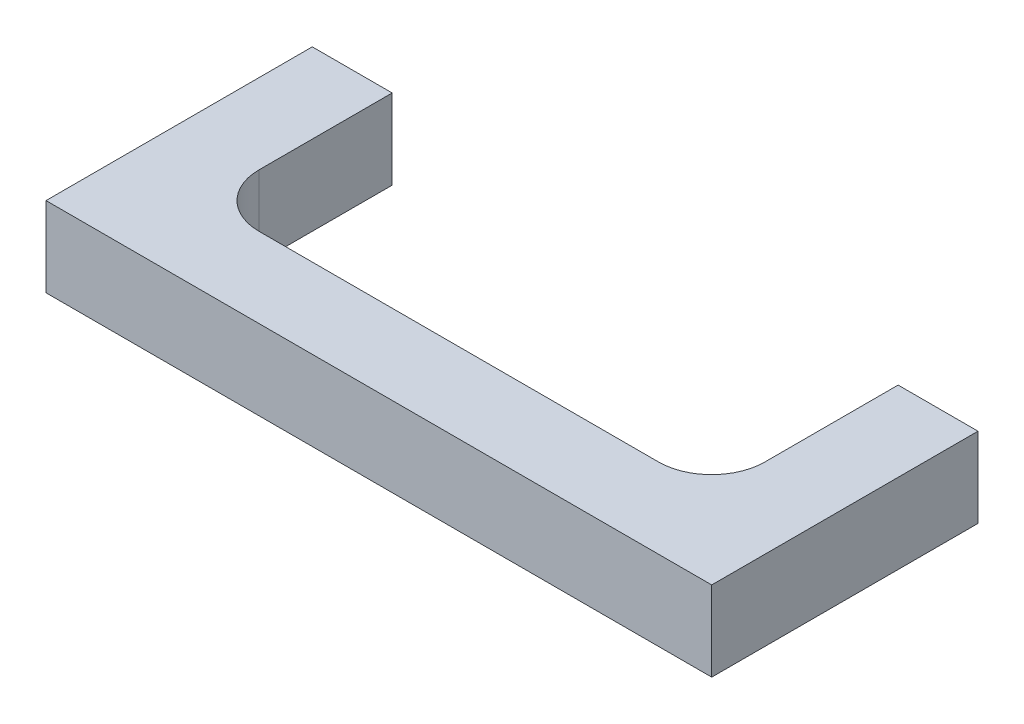
from build123d import *

# Parameters (mm, degrees)
SALIENTE_EXTRUIR1_DEPTH = 3
REDONDEO4_R             = 2
REDONDEO5_R             = 2


with BuildPart() as part:
    # Croquis1 → Saliente-Extruir1 (new body)
    with BuildSketch(Plane(origin=(0, 0, 0), x_dir=(1, 0, 0), z_dir=(0, 1, 0))):
        Polygon((12.5, 0), (-12.5, 0), (-12.5, 10), (-9.5, 10), (-9.5, 3), (9.5, 3), (9.5, 10), (12.5, 10), align=None)
    extrude(amount=-SALIENTE_EXTRUIR1_DEPTH)

    # Redondeo4
    redondeo4_edges = [part.edges().sort_by_distance(p)[0] for p in [
        (-9.5, -1.5, -3),
    ]]
    fillet(redondeo4_edges, radius=REDONDEO4_R)

    # Redondeo5
    redondeo5_edges = [part.edges().sort_by_distance(p)[0] for p in [
        (9.5, -1.5, -3),
    ]]
    fillet(redondeo5_edges, radius=REDONDEO5_R)


solid = part.part
